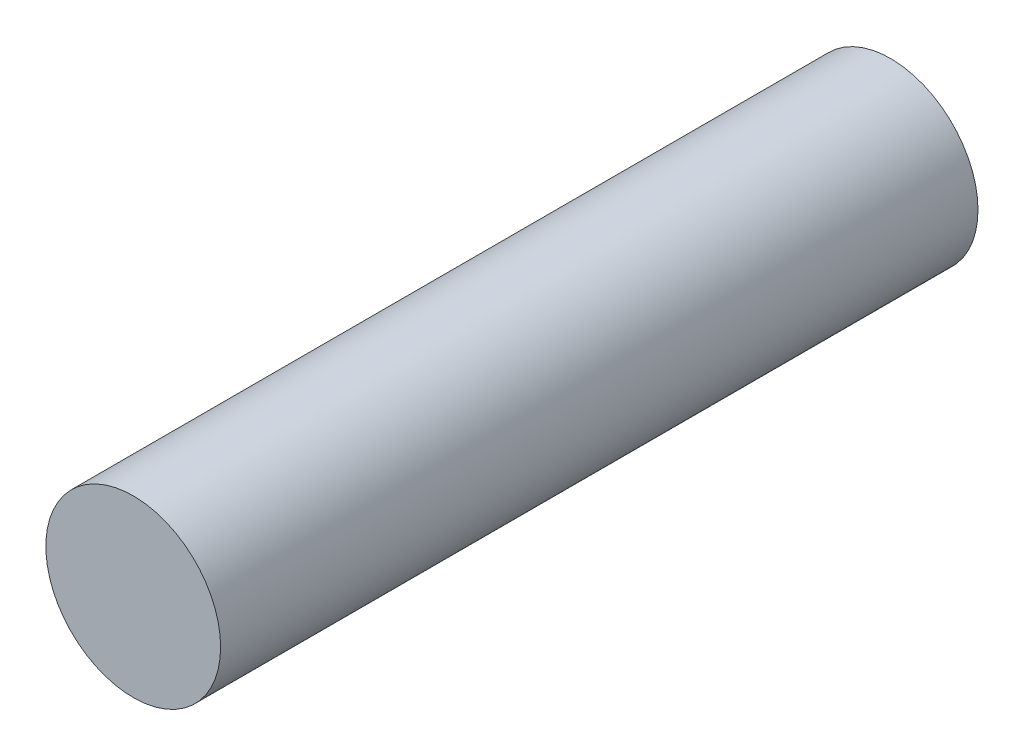
from build123d import *

# Parameters (mm, degrees)
SKETCH1_R           = 7.5
BOSS_EXTRUDE1_DEPTH = 65


with BuildPart() as part:
    # Sketch1 → Boss-Extrude1 (new body)
    with BuildSketch(Plane.XY):
        Circle(SKETCH1_R)
    extrude(amount=BOSS_EXTRUDE1_DEPTH)


solid = part.part
